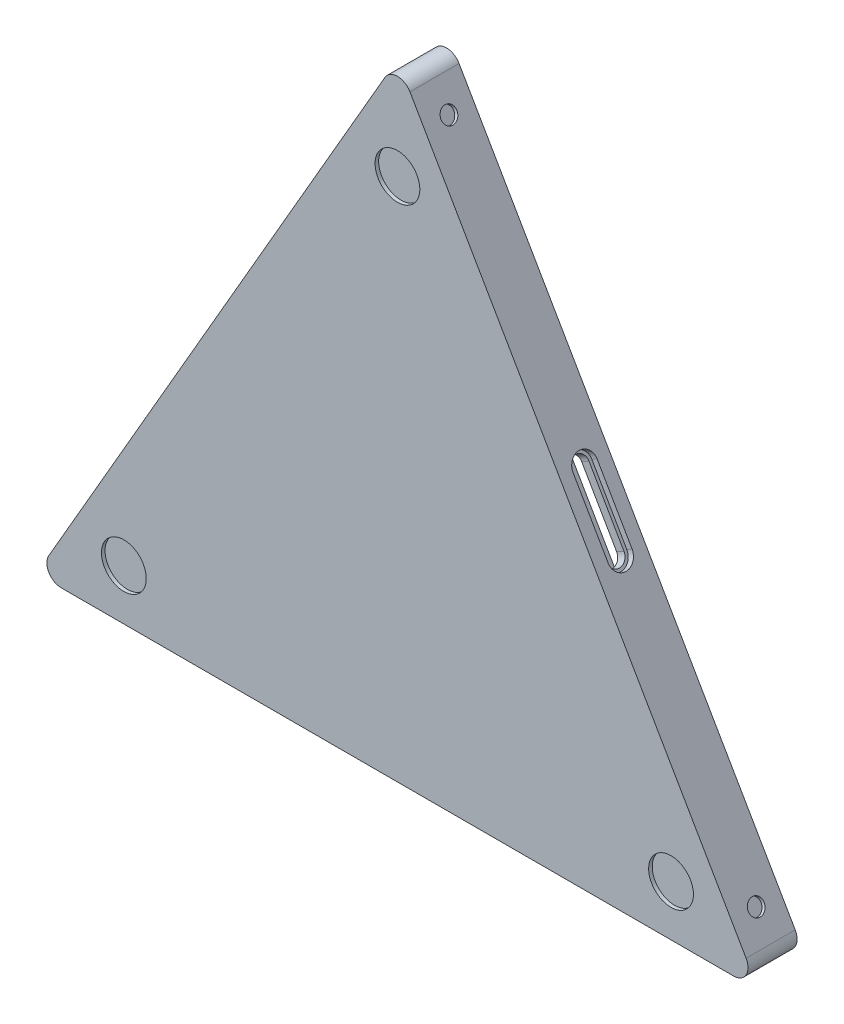
from build123d import *

# Parameters (mm, degrees)
BOSS_EXTRU_1_DEPTH      = 15
BOSS_EXTRU_2_DEPTH      = 2
ESQUISSE3_W             = 163.463234946
ESQUISSE3_H             = 1.5
BOSS_EXTRU_3_DEPTH      = 11
ENL_V_MAT_EXTRU_1_DEPTH = 2.1
ENL_V_MAT_EXTRU_2_REACH = 253.952
CONG_1_R                = 5
ESQUISSE6_R             = 7.75
ENL_V_MAT_EXTRU_3_DEPTH = 1.24
ESQUISSE7_R             = 2.75
ENL_V_MAT_EXTRU_4_DEPTH = 1.24
ESQUISSE8_R             = 2.75
ENL_V_MAT_EXTRU_5_DEPTH = 2.48


with BuildPart() as part:
    # Esquisse1 → Boss.-Extru.1 (new body)
    with BuildSketch(Plane.XY):
        Polygon((-188.46822613, -62.203229112), (-63.46822613, 154.303121834), (61.53177387, -62.203229112), align=None)
        Polygon((52.871519833, -57.203229112), (-179.807972092, -57.203229112), (-63.46822613, 144.303121834), align=None, mode=Mode.SUBTRACT)
    extrude(amount=BOSS_EXTRU_1_DEPTH)

    # Esquisse2 → Boss.-Extru.2 (add)
    with BuildSketch(Plane.XY.offset(15)):
        Polygon((-63.46822613, 154.303121834), (-188.46822613, -62.203229112), (61.53177387, -62.203229112), align=None)
    extrude(amount=BOSS_EXTRU_2_DEPTH)

    # Esquisse3 → Boss.-Extru.3 (add)
    with BuildSketch(Plane(origin=(0, 0, 15), x_dir=(-1, 0, 0), z_dir=(0, 0, -1))):
        Polygon((55.550904435, 120.589918399), (-26.180713039, -20.97339565), (-24.881674933, -21.72339565), (56.84994254, 119.839918399), align=None)
        Polygon((162.980529474, -38.057243537), (161.681491369, -38.807243537), (79.949873895, 102.756070511), (81.248912001, 103.506070511), align=None)
        with Locations((54.104595722, -51.020446973)):
            Rectangle(ESQUISSE3_W, ESQUISSE3_H)
    extrude(amount=BOSS_EXTRU_3_DEPTH)

    # Esquisse4 → Enlèv. mat.-Extru.1 (cut)
    with BuildSketch(Plane(origin=(19.214042099, 11.093232378, 0), x_dir=(0, 0, -1), z_dir=(0.8660254037844387, 0.5000000000000001, 0))):
        with BuildLine():
            Line((-12.65, 52.464536457), (-12.65, 28.264536457))
            ThreePointArc((-12.65, 28.264536457), (-8.5, 24.114536457), (-4.35, 28.264536457))
            Line((-4.35, 28.264536457), (-4.35, 52.464536457))
            ThreePointArc((-4.35, 52.464536457), (-8.5, 56.614536457), (-12.65, 52.464536457))
        make_face()
    enl_v_mat_extru_1 = extrude(amount=-ENL_V_MAT_EXTRU_1_DEPTH, mode=Mode.SUBTRACT)

    # Esquisse5 → Enlèv. mat.-Extru.2 (cut, up to next)
    with BuildSketch(Plane(origin=(17.395388751, 10.043232378, 0), x_dir=(0, 0, -1), z_dir=(0.8660254037844386, 0.5000000000000003, 0)), mode=Mode.PRIVATE) as enl_v_mat_extru_2_sk1:
        with BuildLine():
            Line((-11.65, 52.464536457), (-11.65, 28.264536457))
            ThreePointArc((-11.65, 28.264536457), (-8.5, 25.114536457), (-5.35, 28.264536457))
            Line((-5.35, 28.264536457), (-5.35, 52.464536457))
            ThreePointArc((-5.35, 52.464536457), (-8.5, 55.614536457), (-11.65, 52.464536457))
        make_face()
    enl_v_mat_extru_2_tool1 = extrude(enl_v_mat_extru_2_sk1.sketch, amount=-ENL_V_MAT_EXTRU_2_REACH, mode=Mode.PRIVATE) & part.part
    enl_v_mat_extru_2 = enl_v_mat_extru_2_tool1.solids().sort_by_distance((-2.786879, 44.999946, 8.5))[0]
    add(enl_v_mat_extru_2, mode=Mode.SUBTRACT)

    # Congé1
    cong_1_edges = [part.edges().sort_by_distance(p)[0] for p in [
        (52.871519833, -57.203229112, 7.5),
        (-63.46822613, 144.303121834, 7.5),
        (-179.807972092, -57.203229112, 7.5),
        (-188.46822613, -62.203229112, 8.5),
        (-63.46822613, 154.303121834, 8.5),
        (61.53177387, -62.203229112, 8.5),
    ]]
    fillet(cong_1_edges, radius=CONG_1_R)

    # Symétrie1: Enlèv. mat.-Extru.1, Enlèv. mat.-Extru.2 across plane
    add(enl_v_mat_extru_1.mirror(Plane(origin=(-11.551844836, -20.008382178, 0), x_dir=(0, 0, 1), z_dir=(0.5000000000000001, 0.8660254037844386, 0))), mode=Mode.SUBTRACT)
    add(enl_v_mat_extru_2.mirror(Plane(origin=(-11.551844836, -20.008382178, 0), x_dir=(0, 0, 1), z_dir=(0.5000000000000001, 0.8660254037844386, 0))), mode=Mode.SUBTRACT)

    # Esquisse6 → Enlèv. mat.-Extru.3 (cut)
    with BuildSketch(Plane.XY.offset(17)):
        with Locations((-63.46822613, 119.303121834)):
            Circle(ESQUISSE6_R)
        with Locations(Location((-158.157336997, -44.703229112, 0), (0, 0, 180))):
            Circle(ESQUISSE6_R)
        with Locations((31.220884738, -44.703229112)):
            Circle(ESQUISSE6_R)
    extrude(amount=-ENL_V_MAT_EXTRU_3_DEPTH, mode=Mode.SUBTRACT)

    # Esquisse7 → Enlèv. mat.-Extru.4 (cut)
    with BuildSketch(Plane.XZ.offset(62.203229112)):
        with Locations((42.871519833, 8.5)):
            Circle(ESQUISSE7_R)
        with Locations(Location((-169.807972092, 8.5, 0), (0, 0, 180))):
            Circle(ESQUISSE7_R)
    enl_v_mat_extru_4 = extrude(amount=-ENL_V_MAT_EXTRU_4_DEPTH, mode=Mode.SUBTRACT)

    # Symétrie2: Enlèv. mat.-Extru.4 across plane
    add(enl_v_mat_extru_4.mirror(Plane(origin=(-11.551844836, -20.008382178, 0), x_dir=(0, 0, 1), z_dir=(0.5000000000000001, 0.8660254037844386, 0))), mode=Mode.SUBTRACT)

    # Symétrie3: Enlèv. mat.-Extru.4 across plane
    add(enl_v_mat_extru_4.mirror(Plane(origin=(-20.182268228, 34.956713983, 0), x_dir=(0, 0, 1), z_dir=(0.5000000000000001, -0.8660254037844387, 0))), mode=Mode.SUBTRACT)

    # Esquisse8 → Enlèv. mat.-Extru.5 (cut)
    with BuildSketch(Plane(origin=(0, 0, 0), x_dir=(-1, 0, 0), z_dir=(0, 0, -1))):
        with Locations((-52.871519833, -57.203229112)):
            Circle(ESQUISSE8_R)
        with Locations(Location((63.46822613, 144.303121834, 0), (0, 0, 180))):
            Circle(ESQUISSE8_R)
        with Locations((179.807972092, -57.203229112)):
            Circle(ESQUISSE8_R)
    extrude(amount=-ENL_V_MAT_EXTRU_5_DEPTH, mode=Mode.SUBTRACT)


solid = part.part
